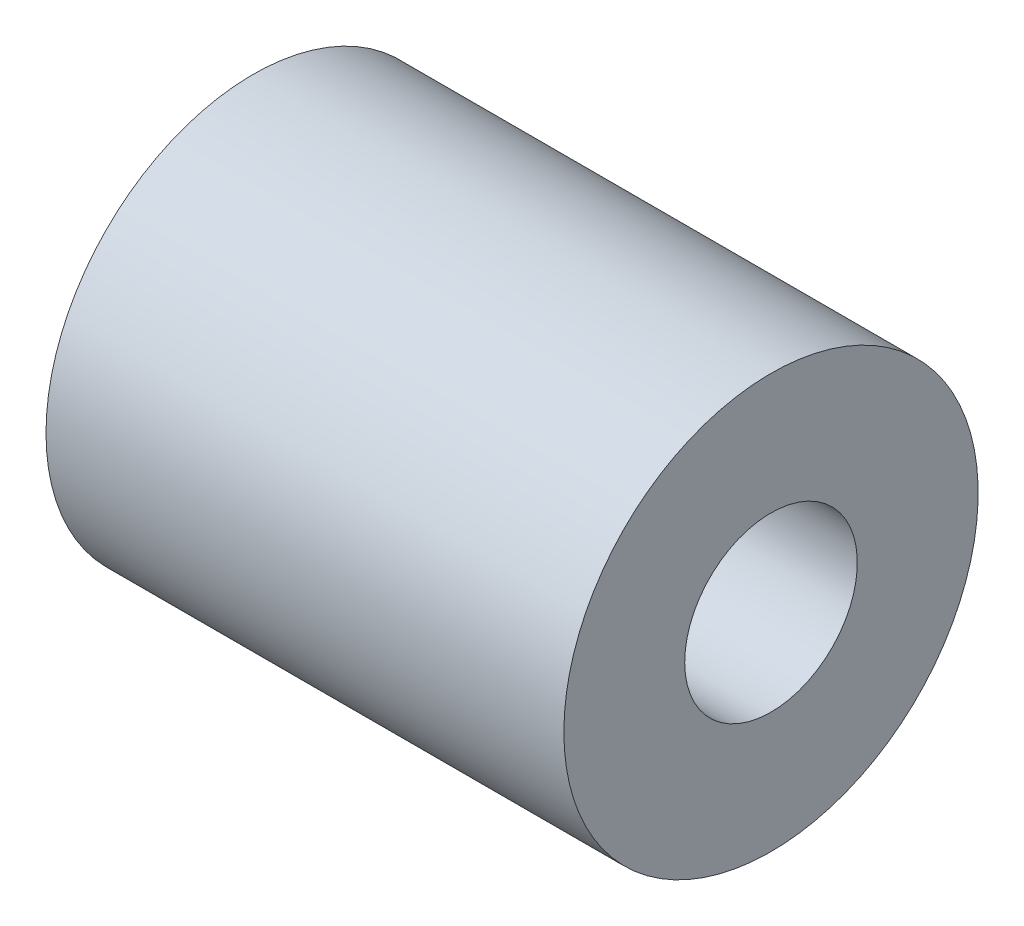
from build123d import *

# Parameters (mm, degrees)
SKETCH_1_W = 9
SKETCH_1_H = 2.1


with BuildPart() as part:
    # 草图1 → 旋转1 (revolve)
    with BuildSketch(Plane.XY, mode=Mode.PRIVATE) as revolve_1_sk:
        with Locations((-4.5, 2.55)):
            Rectangle(SKETCH_1_W, SKETCH_1_H)
    revolve(revolve_1_sk.sketch.rotate(Axis((-25.011627907, 0, 0), (1, 0, 0)), 90), axis=Axis((-25.011627907, 0, 0), (1, 0, 0)))


solid = part.part
